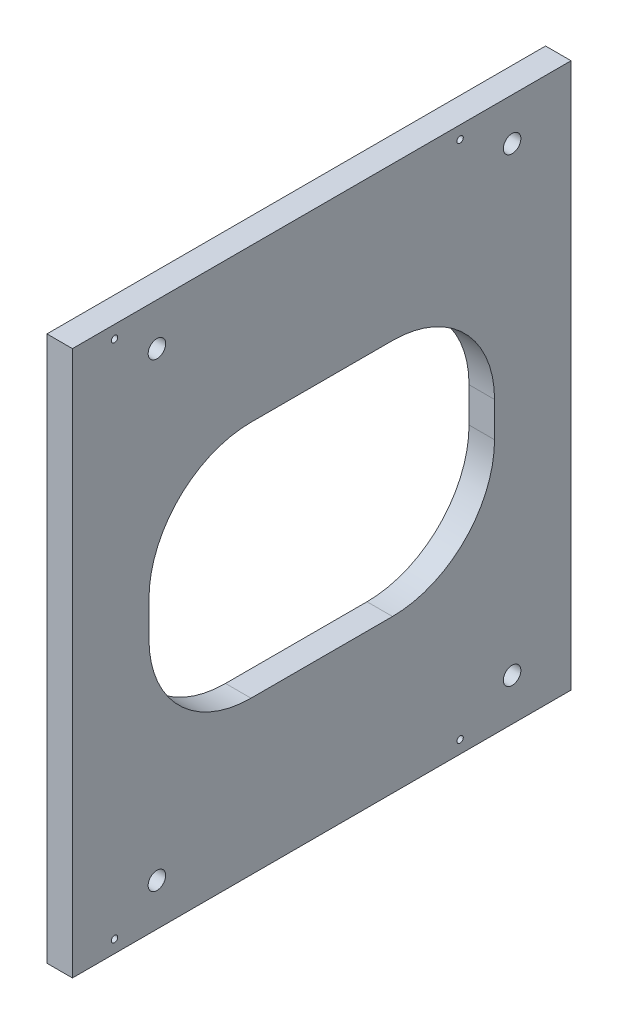
from build123d import *

# Parameters (mm, degrees)
SKETCH1_W                = 12.7
SKETCH1_H                = 271.365530146
BOSS_EXTRUDE1_DEPTH      = 248.25
SKETCH2_W                = 172.05
SKETCH2_H                = 118.965530146
CUT_EXTRUDE1_DEPTH       = 312.978479114
FILLET1_R                = 50.8
HOLE1_D                  = 3.175
HOLE1_DEPTH              = 31.75
HOLE1_CSINK_D            = 10.16
HOLE1_CSINK_ANGLE        = 82
HOLE1_TIP                = 0.953866233
HOLE2_D                  = 3.175
HOLE2_DEPTH              = 31.75
HOLE2_CSINK_D            = 10.16
HOLE2_CSINK_ANGLE        = 82
HOLE2_TIP                = 0.953866233
F_5_16_CLEARANCE_HOLE1_D = 8.72998


with BuildPart() as part:
    # Sketch1 → Boss-Extrude1 (new body)
    with BuildSketch(Plane.XY):
        with Locations((-228.402967181, -52.841023691)):
            Rectangle(SKETCH1_W, SKETCH1_H)
    extrude(amount=BOSS_EXTRUDE1_DEPTH)

    # Sketch2 → Cut-Extrude1 (cut, through all)
    with BuildSketch(Plane.ZY.offset(234.752967181)):
        with Locations((124.125, -52.841023691)):
            Rectangle(SKETCH2_W, SKETCH2_H)
    extrude(amount=-CUT_EXTRUDE1_DEPTH, mode=Mode.SUBTRACT)

    # Fillet1
    fillet1_edges = [part.edges().sort_by_distance(p)[0] for p in [
        (-228.402967181, 6.641741382, 210.15),
        (-228.402967181, -112.323788764, 210.15),
        (-228.402967181, -112.323788764, 38.1),
        (-228.402967181, 6.641741382, 38.1),
    ]]
    fillet(fillet1_edges, radius=FILLET1_R)

    # Hole1
    with Locations(Plane(origin=(181.039434513, -52.974999997, -12.7), x_dir=(0, -1, 0), z_dir=(0, 0, -1))):
        with Locations((129.198788767, 384.042401694), (-129.466741379, 384.042401694), (-129.466741379, 304.786761906), (-110.416741379, 409.442401694), (-0.133976306, 409.442401694), (110.148788767, 409.442401694), (129.198788767, 304.786761906)):
            CounterSinkHole(HOLE1_D / 2, HOLE1_CSINK_D / 2, depth=HOLE1_DEPTH, counter_sink_angle=HOLE1_CSINK_ANGLE)
            with Locations((0, 0, -(HOLE1_DEPTH + HOLE1_TIP / 2))):  # 118° drill point
                Cone(0, HOLE1_D / 2, HOLE1_TIP, mode=Mode.SUBTRACT)

    # Hole2
    with Locations(Plane(origin=(-234.752967181, -52.974999997, -1073.364195846), x_dir=(0, -1, 0), z_dir=(-1, 0, 0))):
        with Locations((-129.466741379, 1300.662770337), (-129.466741379, 1128.612770337), (129.198788767, 1128.612770337), (129.198788767, 1300.662770337)):
            CounterSinkHole(HOLE2_D / 2, HOLE2_CSINK_D / 2, depth=HOLE2_DEPTH, counter_sink_angle=HOLE2_CSINK_ANGLE)
            with Locations((0, 0, -(HOLE2_DEPTH + HOLE2_TIP / 2))):  # 118° drill point
                Cone(0, HOLE2_D / 2, HOLE2_TIP, mode=Mode.SUBTRACT)

    # 5/16 Clearance Hole1 (through all)
    with Locations(Plane.ZY.offset(234.752967181)):
        with Locations((206.1876, -167.467547412), (206.1876, 61.78550003), (29.3624, 61.78550003), (29.3624, -167.467547412)):
            Hole(F_5_16_CLEARANCE_HOLE1_D / 2)


solid = part.part
